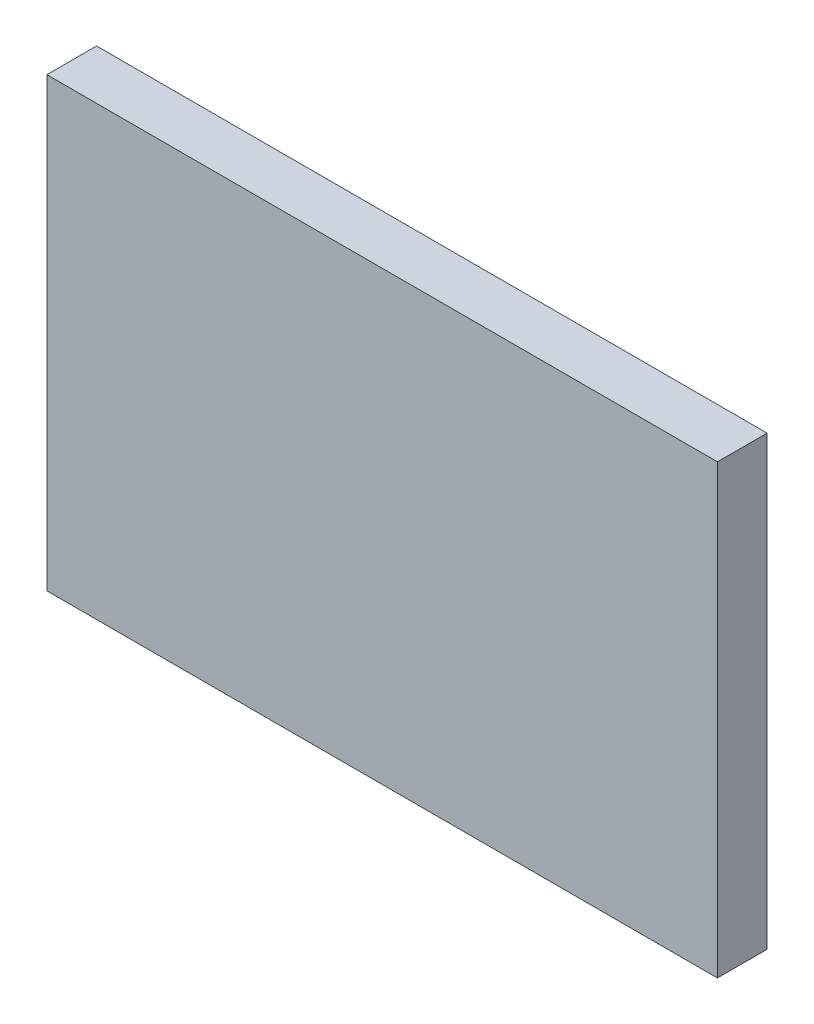
from build123d import *

# Parameters (mm, degrees)
SKETCH1_W           = 171.45
SKETCH1_H           = 114.3
BOSS_EXTRUDE1_DEPTH = 12.7


with BuildPart() as part:
    # Sketch1 → Boss-Extrude1 (new body)
    with BuildSketch(Plane.XY):
        with Locations((85.725, 57.15)):
            Rectangle(SKETCH1_W, SKETCH1_H)
    extrude(amount=BOSS_EXTRUDE1_DEPTH)


solid = part.part
